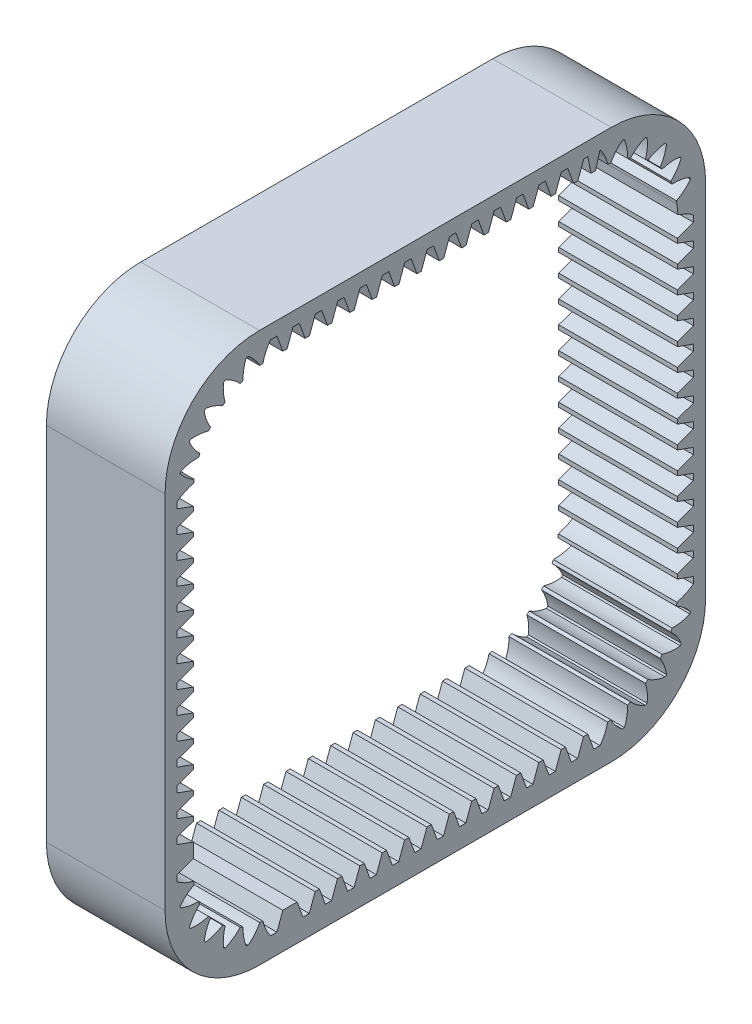
from build123d import *

# Parameters (mm, degrees)
SKETCH_2_W      = 45.556189818
SKETCH_2_H      = 46.322164429
EXTRUDE_1_DEPTH = 10
FILLET_1_R      = 7.95


with BuildPart() as part:
    # 草图2 → 凸台-拉伸1 (new body)
    with BuildSketch(Plane(origin=(0, 0, 0), x_dir=(0, 0, -1), z_dir=(1, 0, 0))):
        with Locations((0, -0.259972406)):
            Rectangle(SKETCH_2_W, SKETCH_2_H)
        with BuildLine():
            ThreePointArc((20.324564986, 14.795021879), (20.34353787, 14.661469062), (20.359777322, 14.527556382))
            Line((20.359777322, 14.527556382), (20.449694695, 13.716845406))
            Line((20.449694695, 13.716845406), (21.32781527, 13.342870196))
            Line((21.32781527, 13.342870196), (21.750573082, 13.041510412))
            Line((21.750573082, 13.041510412), (21.750574481, 12.506987969))
            Line((21.750574481, 12.506987969), (20.400574545, 12.015628065))
            Line((20.400574545, 12.015628065), (20.400574545, 11.647914556))
            Line((20.400574545, 11.647914556), (21.750574545, 11.15655474))
            Line((21.750574545, 11.15655474), (21.750574545, 10.622032296))
            Line((21.750574545, 10.622032296), (20.400574545, 10.13067248))
            Line((20.400574545, 10.13067248), (20.400574545, 9.762958966))
            Line((20.400574545, 9.762958966), (21.750574545, 9.27159915))
            Line((21.750574545, 9.27159915), (21.750574545, 8.737076706))
            Line((21.750574545, 8.737076706), (20.400574545, 8.24571689))
            Line((20.400574545, 8.24571689), (20.400574545, 7.878003376))
            Line((20.400574545, 7.878003376), (21.750574545, 7.38664356))
            Line((21.750574545, 7.38664356), (21.750574545, 6.852121116))
            Line((21.750574545, 6.852121116), (20.400574545, 6.3607613))
            Line((20.400574545, 6.3607613), (20.400574545, 5.993047786))
            Line((20.400574545, 5.993047786), (21.750574545, 5.50168797))
            Line((21.750574545, 5.50168797), (21.750574545, 4.967165526))
            Line((21.750574545, 4.967165526), (20.400574545, 4.47580571))
            Line((20.400574545, 4.47580571), (20.400574545, 4.108092196))
            Line((20.400574545, 4.108092196), (21.750574545, 3.61673238))
            Line((21.750574545, 3.61673238), (21.750574545, 3.082209936))
            Line((21.750574545, 3.082209936), (20.400574545, 2.59085012))
            Line((20.400574545, 2.59085012), (20.400574545, 2.223136606))
            Line((20.400574545, 2.223136606), (21.750574545, 1.73177679))
            Line((21.750574545, 1.73177679), (21.750574545, 1.197254346))
            Line((21.750574545, 1.197254346), (20.400574545, 0.70589453))
            Line((20.400574545, 0.70589453), (20.400574545, 0.338182076))
            Line((20.400574545, 0.338182076), (21.750574545, -0.15317774))
            Line((21.750574545, -0.15317774), (21.750574545, -0.687700184))
            Line((21.750574545, -0.687700184), (20.400574545, -1.17906))
            Line((20.400574545, -1.17906), (20.400574545, -1.546773514))
            Line((20.400574545, -1.546773514), (21.750574545, -2.03813333))
            Line((21.750574545, -2.03813333), (21.750574545, -2.572655774))
            Line((21.750574545, -2.572655774), (20.400574545, -3.06401559))
            Line((20.400574545, -3.06401559), (20.400574545, -3.431729104))
            Line((20.400574545, -3.431729104), (21.750574545, -3.92308892))
            Line((21.750574545, -3.92308892), (21.750574545, -4.457611364))
            Line((21.750574545, -4.457611364), (20.400574545, -4.94897118))
            Line((20.400574545, -4.94897118), (20.400574545, -5.316684694))
            Line((20.400574545, -5.316684694), (21.750574545, -5.80804451))
            Line((21.750574545, -5.80804451), (21.750574545, -6.342566954))
            Line((21.750574545, -6.342566954), (20.400574545, -6.83392677))
            Line((20.400574545, -6.83392677), (20.400574545, -7.201640284))
            Line((20.400574545, -7.201640284), (21.750574545, -7.6930001))
            Line((21.750574545, -7.6930001), (21.750574545, -8.227522544))
            Line((21.750574545, -8.227522544), (20.400574545, -8.71888236))
            Line((20.400574545, -8.71888236), (20.400574545, -9.086595874))
            Line((20.400574545, -9.086595874), (21.750574545, -9.57795569))
            Line((21.750574545, -9.57795569), (21.750574545, -10.112478134))
            Line((21.750574545, -10.112478134), (20.400574545, -10.60383795))
            Line((20.400574545, -10.60383795), (20.400574545, -10.971551464))
            Line((20.400574545, -10.971551464), (21.750574545, -11.46291128))
            Line((21.750574545, -11.46291128), (21.750574545, -11.997433724))
            Line((21.750574545, -11.997433724), (20.400574545, -12.488793364))
            Line((20.400574545, -12.488793364), (20.400574545, -12.856506878))
            Line((20.400574545, -12.856506878), (21.750574512, -13.347866786))
            Line((21.750574512, -13.347866786), (21.750574512, -13.717609735))
            Line((21.750574512, -13.717609735), (21.750574512, -13.882389235))
            ThreePointArc((21.750574512, -13.882389235), (21.089919458, -14.279870019), (20.359777322, -14.527556382))
            ThreePointArc((20.359777322, -14.527556382), (20.34353787, -14.661469062), (20.324564986, -14.795021879))
            ThreePointArc((20.324564986, -14.795021879), (20.965722158, -15.223246499), (21.500989338, -15.778177026))
            ThreePointArc((21.500989338, -15.778177026), (21.480077484, -15.857870494), (21.458340949, -15.937342989))
            ThreePointArc((21.458340949, -15.937342989), (20.717320709, -16.150293332), (19.94795, -16.200568146))
            ThreePointArc((19.94795, -16.200568146), (19.897606103, -16.325711077), (19.844715201, -16.449799005))
            ThreePointArc((19.844715201, -16.449799005), (20.353192785, -17.029375912), (20.726594589, -17.70393498))
            ThreePointArc((20.726594589, -17.70393498), (20.685769103, -17.775500572), (20.644204226, -17.846639277))
            ThreePointArc((20.644204226, -17.846639277), (19.873318035, -17.860543363), (19.117150918, -17.709977312))
            ThreePointArc((19.117150918, -17.709977312), (19.036133074, -17.817826141), (18.952928067, -17.923996702))
            ThreePointArc((18.952928067, -17.923996702), (19.294074156, -18.615428687), (19.480163868, -19.363646211))
            ThreePointArc((19.480163868, -19.363646211), (19.422206939, -19.422206851), (19.3636463, -19.480163781))
            ThreePointArc((19.3636463, -19.480163781), (18.615428776, -19.294074068), (17.923996791, -18.95292798))
            ThreePointArc((17.923996791, -18.95292798), (17.817826232, -19.036132988), (17.709977405, -19.117150834))
            ThreePointArc((17.709977405, -19.117150834), (17.860543456, -19.87331795), (17.846639371, -20.644204142))
            ThreePointArc((17.846639371, -20.644204142), (17.775500668, -20.685769019), (17.703935078, -20.726594506))
            ThreePointArc((17.703935078, -20.726594506), (17.02937601, -20.353192701), (16.449799103, -19.844715118))
            ThreePointArc((16.449799103, -19.844715118), (16.325711178, -19.897606021), (16.20056825, -19.94794992))
            ThreePointArc((16.20056825, -19.94794992), (16.150293394, -20.717320675), (15.937342989, -21.458340949))
            ThreePointArc((15.937342989, -21.458340949), (15.857870494, -21.480077484), (15.778177026, -21.500989338))
            ThreePointArc((15.778177026, -21.500989338), (15.223246499, -20.965722158), (14.795021879, -20.324564986))
            ThreePointArc((14.795021879, -20.324564986), (14.661469062, -20.34353787), (14.527556382, -20.359777322))
            ThreePointArc((14.527556382, -20.359777322), (14.279870019, -21.089919458), (13.882389235, -21.750574512))
            Line((13.882389235, -21.750574512), (13.717609735, -21.750574512))
            Line((13.717609735, -21.750574512), (13.347866786, -21.750574512))
            Line((13.347866786, -21.750574512), (12.856506878, -20.400574545))
            Line((12.856506878, -20.400574545), (12.488793364, -20.400574545))
            Line((12.488793364, -20.400574545), (11.997433724, -21.750574545))
            Line((11.997433724, -21.750574545), (11.46291128, -21.750574545))
            Line((11.46291128, -21.750574545), (10.971551464, -20.400574545))
            Line((10.971551464, -20.400574545), (10.60383795, -20.400574545))
            Line((10.60383795, -20.400574545), (10.112478134, -21.750574545))
            Line((10.112478134, -21.750574545), (9.57795569, -21.750574545))
            Line((9.57795569, -21.750574545), (9.086595874, -20.400574545))
            Line((9.086595874, -20.400574545), (8.71888236, -20.400574545))
            Line((8.71888236, -20.400574545), (8.227522544, -21.750574545))
            Line((8.227522544, -21.750574545), (7.6930001, -21.750574545))
            Line((7.6930001, -21.750574545), (7.201640284, -20.400574545))
            Line((7.201640284, -20.400574545), (6.83392677, -20.400574545))
            Line((6.83392677, -20.400574545), (6.342566954, -21.750574545))
            Line((6.342566954, -21.750574545), (5.80804451, -21.750574545))
            Line((5.80804451, -21.750574545), (5.316684694, -20.400574545))
            Line((5.316684694, -20.400574545), (4.94897118, -20.400574545))
            Line((4.94897118, -20.400574545), (4.457611364, -21.750574545))
            Line((4.457611364, -21.750574545), (3.92308892, -21.750574545))
            Line((3.92308892, -21.750574545), (3.431729104, -20.400574545))
            Line((3.431729104, -20.400574545), (3.06401559, -20.400574545))
            Line((3.06401559, -20.400574545), (2.572655774, -21.750574545))
            Line((2.572655774, -21.750574545), (2.03813333, -21.750574545))
            Line((2.03813333, -21.750574545), (1.546773514, -20.400574545))
            Line((1.546773514, -20.400574545), (1.17906, -20.400574545))
            Line((1.17906, -20.400574545), (0.687700184, -21.750574545))
            Line((0.687700184, -21.750574545), (0.15317774, -21.750574545))
            Line((0.15317774, -21.750574545), (-0.338182076, -20.400574545))
            Line((-0.338182076, -20.400574545), (-0.70589453, -20.400574545))
            Line((-0.70589453, -20.400574545), (-1.197254346, -21.750574545))
            Line((-1.197254346, -21.750574545), (-1.73177679, -21.750574545))
            Line((-1.73177679, -21.750574545), (-2.223136606, -20.400574545))
            Line((-2.223136606, -20.400574545), (-2.59085012, -20.400574545))
            Line((-2.59085012, -20.400574545), (-3.082209936, -21.750574545))
            Line((-3.082209936, -21.750574545), (-3.61673238, -21.750574545))
            Line((-3.61673238, -21.750574545), (-4.108092196, -20.400574545))
            Line((-4.108092196, -20.400574545), (-4.47580571, -20.400574545))
            Line((-4.47580571, -20.400574545), (-4.967165526, -21.750574545))
            Line((-4.967165526, -21.750574545), (-5.50168797, -21.750574545))
            Line((-5.50168797, -21.750574545), (-5.993047786, -20.400574545))
            Line((-5.993047786, -20.400574545), (-6.3607613, -20.400574545))
            Line((-6.3607613, -20.400574545), (-6.852121116, -21.750574545))
            Line((-6.852121116, -21.750574545), (-7.38664356, -21.750574545))
            Line((-7.38664356, -21.750574545), (-7.878003376, -20.400574545))
            Line((-7.878003376, -20.400574545), (-8.24571689, -20.400574545))
            Line((-8.24571689, -20.400574545), (-8.737076706, -21.750574545))
            Line((-8.737076706, -21.750574545), (-9.27159915, -21.750574545))
            Line((-9.27159915, -21.750574545), (-9.762958966, -20.400574545))
            Line((-9.762958966, -20.400574545), (-10.13067248, -20.400574545))
            Line((-10.13067248, -20.400574545), (-10.622032296, -21.750574545))
            Line((-10.622032296, -21.750574545), (-11.15655474, -21.750574545))
            Line((-11.15655474, -21.750574545), (-11.647914556, -20.400574545))
            Line((-11.647914556, -20.400574545), (-12.015628156, -20.400574512))
            Line((-12.015628156, -20.400574512), (-12.856506968, -20.400574512))
            Line((-12.856506968, -20.400574512), (-13.347866786, -21.750574512))
            Line((-13.347866786, -21.750574512), (-13.717609735, -21.750574512))
            Line((-13.717609735, -21.750574512), (-13.882389235, -21.750574512))
            ThreePointArc((-13.882389235, -21.750574512), (-14.279870019, -21.089919458), (-14.527556382, -20.359777322))
            ThreePointArc((-14.527556382, -20.359777322), (-14.661469062, -20.34353787), (-14.795021879, -20.324564986))
            ThreePointArc((-14.795021879, -20.324564986), (-15.223246499, -20.965722158), (-15.778177026, -21.500989338))
            ThreePointArc((-15.778177026, -21.500989338), (-15.857870494, -21.480077484), (-15.937342989, -21.458340949))
            ThreePointArc((-15.937342989, -21.458340949), (-16.150293394, -20.717320675), (-16.20056825, -19.94794992))
            ThreePointArc((-16.20056825, -19.94794992), (-16.325711178, -19.897606021), (-16.449799103, -19.844715118))
            ThreePointArc((-16.449799103, -19.844715118), (-17.02937601, -20.353192701), (-17.703935078, -20.726594506))
            ThreePointArc((-17.703935078, -20.726594506), (-17.775500668, -20.685769019), (-17.846639371, -20.644204142))
            ThreePointArc((-17.846639371, -20.644204142), (-17.860543456, -19.87331795), (-17.709977405, -19.117150834))
            ThreePointArc((-17.709977405, -19.117150834), (-17.817826232, -19.036132988), (-17.923996791, -18.95292798))
            ThreePointArc((-17.923996791, -18.95292798), (-18.615428776, -19.294074068), (-19.3636463, -19.480163781))
            ThreePointArc((-19.3636463, -19.480163781), (-19.422206939, -19.422206851), (-19.480163868, -19.363646211))
            ThreePointArc((-19.480163868, -19.363646211), (-19.294074156, -18.615428687), (-18.952928067, -17.923996702))
            ThreePointArc((-18.952928067, -17.923996702), (-19.036133074, -17.817826141), (-19.117150918, -17.709977312))
            ThreePointArc((-19.117150918, -17.709977312), (-19.873318035, -17.860543363), (-20.644204226, -17.846639277))
            ThreePointArc((-20.644204226, -17.846639277), (-20.685769103, -17.775500572), (-20.726594589, -17.70393498))
            ThreePointArc((-20.726594589, -17.70393498), (-20.353192785, -17.029375912), (-19.844715201, -16.449799005))
            ThreePointArc((-19.844715201, -16.449799005), (-19.897606103, -16.325711077), (-19.94795, -16.200568146))
            ThreePointArc((-19.94795, -16.200568146), (-20.717320709, -16.150293332), (-21.458340949, -15.937342989))
            ThreePointArc((-21.458340949, -15.937342989), (-21.480077484, -15.857870494), (-21.500989338, -15.778177026))
            ThreePointArc((-21.500989338, -15.778177026), (-20.965722158, -15.223246499), (-20.324564986, -14.795021879))
            ThreePointArc((-20.324564986, -14.795021879), (-20.34353787, -14.661469062), (-20.359777322, -14.527556382))
            ThreePointArc((-20.359777322, -14.527556382), (-21.089919458, -14.279870019), (-21.750574512, -13.882389235))
            Line((-21.750574512, -13.882389235), (-21.750574512, -13.717609735))
            Line((-21.750574512, -13.717609735), (-21.750574512, -13.347866786))
            Line((-21.750574512, -13.347866786), (-20.400574512, -12.856506968))
            Line((-20.400574512, -12.856506968), (-20.400574512, -12.015628156))
            Line((-20.400574512, -12.015628156), (-20.400574545, -11.647914556))
            Line((-20.400574545, -11.647914556), (-21.750574545, -11.15655474))
            Line((-21.750574545, -11.15655474), (-21.750574545, -10.622032296))
            Line((-21.750574545, -10.622032296), (-20.400574545, -10.13067248))
            Line((-20.400574545, -10.13067248), (-20.400574545, -9.762958966))
            Line((-20.400574545, -9.762958966), (-21.750574545, -9.27159915))
            Line((-21.750574545, -9.27159915), (-21.750574545, -8.737076706))
            Line((-21.750574545, -8.737076706), (-20.400574545, -8.24571689))
            Line((-20.400574545, -8.24571689), (-20.400574545, -7.878003376))
            Line((-20.400574545, -7.878003376), (-21.750574545, -7.38664356))
            Line((-21.750574545, -7.38664356), (-21.750574545, -6.852121116))
            Line((-21.750574545, -6.852121116), (-20.400574545, -6.3607613))
            Line((-20.400574545, -6.3607613), (-20.400574545, -5.993047786))
            Line((-20.400574545, -5.993047786), (-21.750574545, -5.50168797))
            Line((-21.750574545, -5.50168797), (-21.750574545, -4.967165526))
            Line((-21.750574545, -4.967165526), (-20.400574545, -4.47580571))
            Line((-20.400574545, -4.47580571), (-20.400574545, -4.108092196))
            Line((-20.400574545, -4.108092196), (-21.750574545, -3.61673238))
            Line((-21.750574545, -3.61673238), (-21.750574545, -3.082209936))
            Line((-21.750574545, -3.082209936), (-20.400574545, -2.59085012))
            Line((-20.400574545, -2.59085012), (-20.400574545, -2.223136606))
            Line((-20.400574545, -2.223136606), (-21.750574545, -1.73177679))
            Line((-21.750574545, -1.73177679), (-21.750574545, -1.197254346))
            Line((-21.750574545, -1.197254346), (-20.400574545, -0.70589453))
            Line((-20.400574545, -0.70589453), (-20.400574545, -0.338182076))
            Line((-20.400574545, -0.338182076), (-21.750574545, 0.15317774))
            Line((-21.750574545, 0.15317774), (-21.750574545, 0.687700184))
            Line((-21.750574545, 0.687700184), (-20.400574545, 1.17906))
            Line((-20.400574545, 1.17906), (-20.400574545, 1.546773514))
            Line((-20.400574545, 1.546773514), (-21.750574545, 2.03813333))
            Line((-21.750574545, 2.03813333), (-21.750574545, 2.572655774))
            Line((-21.750574545, 2.572655774), (-20.400574545, 3.06401559))
            Line((-20.400574545, 3.06401559), (-20.400574545, 3.431729104))
            Line((-20.400574545, 3.431729104), (-21.750574545, 3.92308892))
            Line((-21.750574545, 3.92308892), (-21.750574545, 4.457611364))
            Line((-21.750574545, 4.457611364), (-20.400574545, 4.94897118))
            Line((-20.400574545, 4.94897118), (-20.400574545, 5.316684694))
            Line((-20.400574545, 5.316684694), (-21.750574545, 5.80804451))
            Line((-21.750574545, 5.80804451), (-21.750574545, 6.342566954))
            Line((-21.750574545, 6.342566954), (-20.400574545, 6.83392677))
            Line((-20.400574545, 6.83392677), (-20.400574545, 7.201640284))
            Line((-20.400574545, 7.201640284), (-21.750574545, 7.6930001))
            Line((-21.750574545, 7.6930001), (-21.750574545, 8.227522544))
            Line((-21.750574545, 8.227522544), (-20.400574545, 8.71888236))
            Line((-20.400574545, 8.71888236), (-20.400574545, 9.086595874))
            Line((-20.400574545, 9.086595874), (-21.750574545, 9.57795569))
            Line((-21.750574545, 9.57795569), (-21.750574545, 10.112478134))
            Line((-21.750574545, 10.112478134), (-20.400574545, 10.60383795))
            Line((-20.400574545, 10.60383795), (-20.400574545, 10.971551464))
            Line((-20.400574545, 10.971551464), (-21.750574545, 11.46291128))
            Line((-21.750574545, 11.46291128), (-21.750574545, 11.997433724))
            Line((-21.750574545, 11.997433724), (-20.400574545, 12.488793364))
            Line((-20.400574545, 12.488793364), (-20.400574545, 12.856506878))
            Line((-20.400574545, 12.856506878), (-21.750574512, 13.347866786))
            Line((-21.750574512, 13.347866786), (-21.750574512, 13.717609735))
            Line((-21.750574512, 13.717609735), (-21.750574512, 13.882389235))
            ThreePointArc((-21.750574512, 13.882389235), (-21.089919458, 14.279870019), (-20.359777322, 14.527556382))
            ThreePointArc((-20.359777322, 14.527556382), (-20.34353787, 14.661469062), (-20.324564986, 14.795021879))
            ThreePointArc((-20.324564986, 14.795021879), (-20.965722158, 15.223246499), (-21.500989338, 15.778177026))
            ThreePointArc((-21.500989338, 15.778177026), (-21.480077484, 15.857870494), (-21.458340949, 15.937342989))
            ThreePointArc((-21.458340949, 15.937342989), (-20.717320675, 16.150293394), (-19.94794992, 16.20056825))
            ThreePointArc((-19.94794992, 16.20056825), (-19.897606021, 16.325711178), (-19.844715118, 16.449799103))
            ThreePointArc((-19.844715118, 16.449799103), (-20.353192701, 17.02937601), (-20.726594506, 17.703935078))
            ThreePointArc((-20.726594506, 17.703935078), (-20.685769019, 17.775500668), (-20.644204142, 17.846639371))
            ThreePointArc((-20.644204142, 17.846639371), (-19.87331795, 17.860543456), (-19.117150834, 17.709977405))
            ThreePointArc((-19.117150834, 17.709977405), (-19.036132988, 17.817826232), (-18.95292798, 17.923996791))
            ThreePointArc((-18.95292798, 17.923996791), (-19.294074068, 18.615428776), (-19.480163781, 19.3636463))
            ThreePointArc((-19.480163781, 19.3636463), (-19.422206851, 19.422206939), (-19.363646211, 19.480163868))
            ThreePointArc((-19.363646211, 19.480163868), (-18.615428687, 19.294074156), (-17.923996702, 18.952928067))
            ThreePointArc((-17.923996702, 18.952928067), (-17.817826141, 19.036133074), (-17.709977312, 19.117150918))
            ThreePointArc((-17.709977312, 19.117150918), (-17.860543363, 19.873318035), (-17.846639277, 20.644204226))
            ThreePointArc((-17.846639277, 20.644204226), (-17.775500572, 20.685769103), (-17.70393498, 20.726594589))
            ThreePointArc((-17.70393498, 20.726594589), (-17.029375912, 20.353192785), (-16.449799005, 19.844715201))
            ThreePointArc((-16.449799005, 19.844715201), (-16.325711077, 19.897606103), (-16.200568146, 19.94795))
            ThreePointArc((-16.200568146, 19.94795), (-16.150293332, 20.717320709), (-15.937342989, 21.458340949))
            ThreePointArc((-15.937342989, 21.458340949), (-15.857870494, 21.480077484), (-15.778177026, 21.500989338))
            ThreePointArc((-15.778177026, 21.500989338), (-15.223246499, 20.965722158), (-14.795021879, 20.324564986))
            ThreePointArc((-14.795021879, 20.324564986), (-14.661469062, 20.34353787), (-14.527556382, 20.359777322))
            ThreePointArc((-14.527556382, 20.359777322), (-14.279870019, 21.089919458), (-13.882389235, 21.750574512))
            Line((-13.882389235, 21.750574512), (-13.717609735, 21.750574512))
            Line((-13.717609735, 21.750574512), (-13.347866786, 21.750574512))
            Line((-13.347866786, 21.750574512), (-12.856506878, 20.400574545))
            Line((-12.856506878, 20.400574545), (-12.488793364, 20.400574545))
            Line((-12.488793364, 20.400574545), (-11.997433724, 21.750574545))
            Line((-11.997433724, 21.750574545), (-11.46291128, 21.750574545))
            Line((-11.46291128, 21.750574545), (-10.971551464, 20.400574545))
            Line((-10.971551464, 20.400574545), (-10.60383795, 20.400574545))
            Line((-10.60383795, 20.400574545), (-10.112478134, 21.750574545))
            Line((-10.112478134, 21.750574545), (-9.57795569, 21.750574545))
            Line((-9.57795569, 21.750574545), (-9.086595874, 20.400574545))
            Line((-9.086595874, 20.400574545), (-8.71888236, 20.400574545))
            Line((-8.71888236, 20.400574545), (-8.227522544, 21.750574545))
            Line((-8.227522544, 21.750574545), (-7.6930001, 21.750574545))
            Line((-7.6930001, 21.750574545), (-7.201640284, 20.400574545))
            Line((-7.201640284, 20.400574545), (-6.83392677, 20.400574545))
            Line((-6.83392677, 20.400574545), (-6.342566954, 21.750574545))
            Line((-6.342566954, 21.750574545), (-5.80804451, 21.750574545))
            Line((-5.80804451, 21.750574545), (-5.316684694, 20.400574545))
            Line((-5.316684694, 20.400574545), (-4.94897118, 20.400574545))
            Line((-4.94897118, 20.400574545), (-4.457611364, 21.750574545))
            Line((-4.457611364, 21.750574545), (-3.92308892, 21.750574545))
            Line((-3.92308892, 21.750574545), (-3.431729104, 20.400574545))
            Line((-3.431729104, 20.400574545), (-3.06401559, 20.400574545))
            Line((-3.06401559, 20.400574545), (-2.572655774, 21.750574545))
            Line((-2.572655774, 21.750574545), (-2.03813333, 21.750574545))
            Line((-2.03813333, 21.750574545), (-1.546773514, 20.400574545))
            Line((-1.546773514, 20.400574545), (-1.17906, 20.400574545))
            Line((-1.17906, 20.400574545), (-0.687700184, 21.750574545))
            Line((-0.687700184, 21.750574545), (-0.15317774, 21.750574545))
            Line((-0.15317774, 21.750574545), (0.338182076, 20.400574545))
            Line((0.338182076, 20.400574545), (0.70589453, 20.400574545))
            Line((0.70589453, 20.400574545), (1.197254346, 21.750574545))
            Line((1.197254346, 21.750574545), (1.73177679, 21.750574545))
            Line((1.73177679, 21.750574545), (2.223136606, 20.400574545))
            Line((2.223136606, 20.400574545), (2.59085012, 20.400574545))
            Line((2.59085012, 20.400574545), (3.082209936, 21.750574545))
            Line((3.082209936, 21.750574545), (3.61673238, 21.750574545))
            Line((3.61673238, 21.750574545), (4.108092196, 20.400574545))
            Line((4.108092196, 20.400574545), (4.47580571, 20.400574545))
            Line((4.47580571, 20.400574545), (4.967165526, 21.750574545))
            Line((4.967165526, 21.750574545), (5.50168797, 21.750574545))
            Line((5.50168797, 21.750574545), (5.993047786, 20.400574545))
            Line((5.993047786, 20.400574545), (6.3607613, 20.400574545))
            Line((6.3607613, 20.400574545), (6.852121116, 21.750574545))
            Line((6.852121116, 21.750574545), (7.38664356, 21.750574545))
            Line((7.38664356, 21.750574545), (7.878003376, 20.400574545))
            Line((7.878003376, 20.400574545), (8.24571689, 20.400574545))
            Line((8.24571689, 20.400574545), (8.737076706, 21.750574545))
            Line((8.737076706, 21.750574545), (9.27159915, 21.750574545))
            Line((9.27159915, 21.750574545), (9.762958966, 20.400574545))
            Line((9.762958966, 20.400574545), (10.13067248, 20.400574545))
            Line((10.13067248, 20.400574545), (10.622032296, 21.750574545))
            Line((10.622032296, 21.750574545), (11.15655474, 21.750574545))
            Line((11.15655474, 21.750574545), (11.647914556, 20.400574545))
            Line((11.647914556, 20.400574545), (12.015628065, 20.400574545))
            Line((12.015628065, 20.400574545), (12.506824112, 21.750124289))
            Line((12.506824112, 21.750124289), (12.506987969, 21.750574481))
            Line((12.506987969, 21.750574481), (12.856506872, 21.750573544))
            Line((12.856506872, 21.750573544), (12.85662228, 21.749995545))
            Line((12.85662228, 21.749995545), (13.126057841, 20.400574475))
            Line((13.126057841, 20.400574475), (13.497574066, 20.400574475))
            Line((13.497574066, 20.400574475), (13.883154594, 21.749565102))
            ThreePointArc((13.883154594, 21.749565102), (14.280136501, 21.089344864), (14.527556382, 20.359777322))
            ThreePointArc((14.527556382, 20.359777322), (14.661469062, 20.34353787), (14.795021879, 20.324564986))
            ThreePointArc((14.795021879, 20.324564986), (15.223246499, 20.965722158), (15.778177026, 21.500989338))
            ThreePointArc((15.778177026, 21.500989338), (15.857870494, 21.480077484), (15.937342989, 21.458340949))
            ThreePointArc((15.937342989, 21.458340949), (16.150293332, 20.717320709), (16.200568146, 19.94795))
            ThreePointArc((16.200568146, 19.94795), (16.325711077, 19.897606103), (16.449799005, 19.844715201))
            ThreePointArc((16.449799005, 19.844715201), (17.029375912, 20.353192785), (17.70393498, 20.726594589))
            ThreePointArc((17.70393498, 20.726594589), (17.775500572, 20.685769103), (17.846639277, 20.644204226))
            ThreePointArc((17.846639277, 20.644204226), (17.860543363, 19.873318035), (17.709977312, 19.117150918))
            ThreePointArc((17.709977312, 19.117150918), (17.817826141, 19.036133074), (17.923996702, 18.952928067))
            ThreePointArc((17.923996702, 18.952928067), (18.615428687, 19.294074156), (19.363646211, 19.480163868))
            ThreePointArc((19.363646211, 19.480163868), (19.422206851, 19.422206939), (19.480163781, 19.3636463))
            ThreePointArc((19.480163781, 19.3636463), (19.294074068, 18.615428776), (18.95292798, 17.923996791))
            ThreePointArc((18.95292798, 17.923996791), (19.036132988, 17.817826232), (19.117150834, 17.709977405))
            ThreePointArc((19.117150834, 17.709977405), (19.87331795, 17.860543456), (20.644204142, 17.846639371))
            ThreePointArc((20.644204142, 17.846639371), (20.685769019, 17.775500668), (20.726594506, 17.703935078))
            ThreePointArc((20.726594506, 17.703935078), (20.353192701, 17.02937601), (19.844715118, 16.449799103))
            ThreePointArc((19.844715118, 16.449799103), (19.897606021, 16.325711178), (19.94794992, 16.20056825))
            ThreePointArc((19.94794992, 16.20056825), (20.717320675, 16.150293394), (21.458340949, 15.937342989))
            ThreePointArc((21.458340949, 15.937342989), (21.480077484, 15.857870494), (21.500989338, 15.778177026))
            ThreePointArc((21.500989338, 15.778177026), (20.965722158, 15.223246499), (20.324564986, 14.795021879))
        make_face(mode=Mode.SUBTRACT)
    extrude(amount=EXTRUDE_1_DEPTH)

    # 圆角1
    fillet_1_edges = [part.edges().sort_by_distance(p)[0] for p in [
        (5, 22.901109808, 22.778094909),
        (5, 22.901109808, -22.778094909),
        (5, -23.421054621, -22.778094909),
        (5, -23.421054621, 22.778094909),
    ]]
    fillet(fillet_1_edges, radius=FILLET_1_R)


solid = part.part
